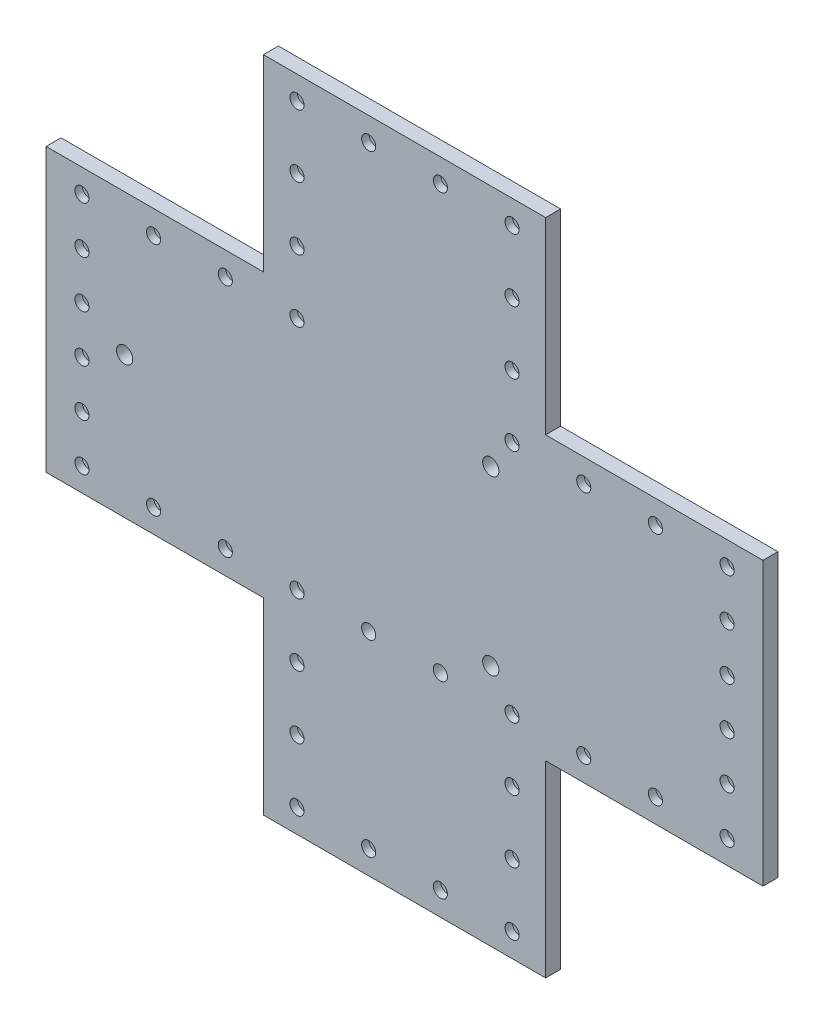
from build123d import *

# Parameters (mm, degrees)
SKETCH1_R               = 1.5
BOSS_EXTRUDE1_DEPTH     = 3.18
SKETCH1_6_R             = 1.5
BOSS_EXTRUDE2_DEPTH     = 1.59
CUT_EXTRUDE1_DEPTH      = 183.307082693
CUT_EXTRUDE1_DEPTH_BACK = 183.307082693
SKETCH2_R               = 1.725


with BuildPart() as part:
    # Sketch1 → Boss-Extrude1 (new body)
    with BuildSketch(Plane.XY):
        Polygon((46.2, 0), (0, 0), (0, -60), (46.2, -60), (46.2, -100), (106.2, -100), (106.2, -60), (152.4, -60), (152.4, 0), (106.2, 0), (106.2, 40), (46.2, 40), align=None)
        with Locations((7.62, -55)):
            Circle(SKETCH1_R, mode=Mode.SUBTRACT)
        with Locations((22.86, -55)):
            Circle(SKETCH1_R, mode=Mode.SUBTRACT)
        with Locations((7.62, -45)):
            Circle(SKETCH1_R, mode=Mode.SUBTRACT)
        with Locations((7.62, -35)):
            Circle(SKETCH1_R, mode=Mode.SUBTRACT)
        with Locations((38.1, -55)):
            Circle(SKETCH1_R, mode=Mode.SUBTRACT)
        with Locations((53.34, -55)):
            Circle(SKETCH1_R, mode=Mode.SUBTRACT)
        with Locations((68.58, -55)):
            Circle(SKETCH1_R, mode=Mode.SUBTRACT)
        with Locations((83.82, -55)):
            Circle(SKETCH1_R, mode=Mode.SUBTRACT)
        with Locations((99.06, -55)):
            Circle(SKETCH1_R, mode=Mode.SUBTRACT)
        with Locations((114.3, -55)):
            Circle(SKETCH1_R, mode=Mode.SUBTRACT)
        with Locations((129.54, -55)):
            Circle(SKETCH1_R, mode=Mode.SUBTRACT)
        with Locations((144.78, -55)):
            Circle(SKETCH1_R, mode=Mode.SUBTRACT)
        with Locations((144.78, -45)):
            Circle(SKETCH1_R, mode=Mode.SUBTRACT)
        with Locations((144.78, -35)):
            Circle(SKETCH1_R, mode=Mode.SUBTRACT)
        with Locations((7.62, -25)):
            Circle(SKETCH1_R, mode=Mode.SUBTRACT)
        with Locations((7.62, -15)):
            Circle(SKETCH1_R, mode=Mode.SUBTRACT)
        with Locations((7.62, -5)):
            Circle(SKETCH1_R, mode=Mode.SUBTRACT)
        with Locations((22.86, -5)):
            Circle(SKETCH1_R, mode=Mode.SUBTRACT)
        with Locations((38.1, -5)):
            Circle(SKETCH1_R, mode=Mode.SUBTRACT)
        with Locations((53.34, -5)):
            Circle(SKETCH1_R, mode=Mode.SUBTRACT)
        with Locations((99.06, -5)):
            Circle(SKETCH1_R, mode=Mode.SUBTRACT)
        with Locations((144.78, -25)):
            Circle(SKETCH1_R, mode=Mode.SUBTRACT)
        with Locations((144.78, -15)):
            Circle(SKETCH1_R, mode=Mode.SUBTRACT)
        with Locations((114.3, -5)):
            Circle(SKETCH1_R, mode=Mode.SUBTRACT)
        with Locations((129.54, -5)):
            Circle(SKETCH1_R, mode=Mode.SUBTRACT)
        with Locations((144.78, -5)):
            Circle(SKETCH1_R, mode=Mode.SUBTRACT)
        with Locations((99.06, 35)):
            Circle(SKETCH1_R, mode=Mode.SUBTRACT)
        with Locations((53.34, 8.333333333)):
            Circle(SKETCH1_R, mode=Mode.SUBTRACT)
        with Locations((53.34, 21.666666667)):
            Circle(SKETCH1_R, mode=Mode.SUBTRACT)
        with Locations((53.34, 35)):
            Circle(SKETCH1_R, mode=Mode.SUBTRACT)
        with Locations((68.58, 35)):
            Circle(SKETCH1_R, mode=Mode.SUBTRACT)
        with Locations((99.06, 8.333333333)):
            Circle(SKETCH1_R, mode=Mode.SUBTRACT)
        with Locations((99.06, 21.666666667)):
            Circle(SKETCH1_R, mode=Mode.SUBTRACT)
        with Locations((83.82, 35)):
            Circle(SKETCH1_R, mode=Mode.SUBTRACT)
        with Locations((99.06, -68.333333333)):
            Circle(SKETCH1_R, mode=Mode.SUBTRACT)
        with Locations((53.34, -95)):
            Circle(SKETCH1_R, mode=Mode.SUBTRACT)
        with Locations((68.58, -95)):
            Circle(SKETCH1_R, mode=Mode.SUBTRACT)
        with Locations((53.34, -81.666666667)):
            Circle(SKETCH1_R, mode=Mode.SUBTRACT)
        with Locations((53.34, -68.333333333)):
            Circle(SKETCH1_R, mode=Mode.SUBTRACT)
        with Locations((83.82, -95)):
            Circle(SKETCH1_R, mode=Mode.SUBTRACT)
        with Locations((99.06, -95)):
            Circle(SKETCH1_R, mode=Mode.SUBTRACT)
        with Locations((99.06, -81.666666667)):
            Circle(SKETCH1_R, mode=Mode.SUBTRACT)
    extrude(amount=BOSS_EXTRUDE1_DEPTH)

    # Sketch1<6> → Boss-Extrude2 (add)
    with BuildSketch(Plane.XY):
        with Locations((7.62, -55)):
            Circle(SKETCH1_6_R)
        with Locations((22.86, -55)):
            Circle(SKETCH1_6_R)
        with Locations((38.1, -55)):
            Circle(SKETCH1_6_R)
        with Locations((53.34, -55)):
            Circle(SKETCH1_6_R)
        with Locations((99.06, -55)):
            Circle(SKETCH1_6_R)
        with Locations((114.3, -55)):
            Circle(SKETCH1_6_R)
        with Locations((129.54, -55)):
            Circle(SKETCH1_6_R)
        with Locations((144.78, -55)):
            Circle(SKETCH1_6_R)
        with Locations((53.34, -68.333333333)):
            Circle(SKETCH1_6_R)
        with Locations((53.34, -81.666666667)):
            Circle(SKETCH1_6_R)
        with Locations((53.34, -95)):
            Circle(SKETCH1_6_R)
        with Locations((68.58, -95)):
            Circle(SKETCH1_6_R)
        with Locations((83.82, -95)):
            Circle(SKETCH1_6_R)
        with Locations((99.06, -95)):
            Circle(SKETCH1_6_R)
        with Locations((99.06, -81.666666667)):
            Circle(SKETCH1_6_R)
        with Locations((99.06, -68.333333333)):
            Circle(SKETCH1_6_R)
        with Locations((7.62, -45)):
            Circle(SKETCH1_6_R)
        with Locations((7.62, -35)):
            Circle(SKETCH1_6_R)
        with Locations((144.78, -45)):
            Circle(SKETCH1_6_R)
        with Locations((144.78, -35)):
            Circle(SKETCH1_6_R)
        with Locations((144.78, -25)):
            Circle(SKETCH1_6_R)
        with Locations((144.78, -15)):
            Circle(SKETCH1_6_R)
        with Locations((144.78, -5)):
            Circle(SKETCH1_6_R)
        with Locations((129.54, -5)):
            Circle(SKETCH1_6_R)
        with Locations((114.3, -5)):
            Circle(SKETCH1_6_R)
        with Locations((99.06, -5)):
            Circle(SKETCH1_6_R)
        with Locations((99.06, 8.333333333)):
            Circle(SKETCH1_6_R)
        with Locations((99.06, 21.666666667)):
            Circle(SKETCH1_6_R)
        with Locations((99.06, 35)):
            Circle(SKETCH1_6_R)
        with Locations((83.82, 35)):
            Circle(SKETCH1_6_R)
        with Locations((68.58, 35)):
            Circle(SKETCH1_6_R)
        with Locations((53.34, 35)):
            Circle(SKETCH1_6_R)
        with Locations((53.34, 21.666666667)):
            Circle(SKETCH1_6_R)
        with Locations((53.34, 8.333333333)):
            Circle(SKETCH1_6_R)
        with Locations((53.34, -5)):
            Circle(SKETCH1_6_R)
        with Locations((38.1, -5)):
            Circle(SKETCH1_6_R)
        with Locations((22.86, -5)):
            Circle(SKETCH1_6_R)
        with Locations((7.62, -5)):
            Circle(SKETCH1_6_R)
        with Locations((7.62, -15)):
            Circle(SKETCH1_6_R)
        with Locations((7.62, -25)):
            Circle(SKETCH1_6_R)
    extrude(amount=BOSS_EXTRUDE2_DEPTH)

    # Sketch2 → Cut-Extrude1 (cut, two sides: drawn at the far end of the back side and taken through both)
    with BuildSketch(Plane.XY.offset(3.18).offset(-CUT_EXTRUDE1_DEPTH_BACK)):
        with Locations((94.5382, -11.6618)):
            Circle(SKETCH2_R)
        with Locations((94.5382, -48.3382)):
            Circle(SKETCH2_R)
        with Locations((16.7, -30)):
            Circle(SKETCH2_R)
    extrude(amount=CUT_EXTRUDE1_DEPTH + CUT_EXTRUDE1_DEPTH_BACK, mode=Mode.SUBTRACT)


solid = part.part
